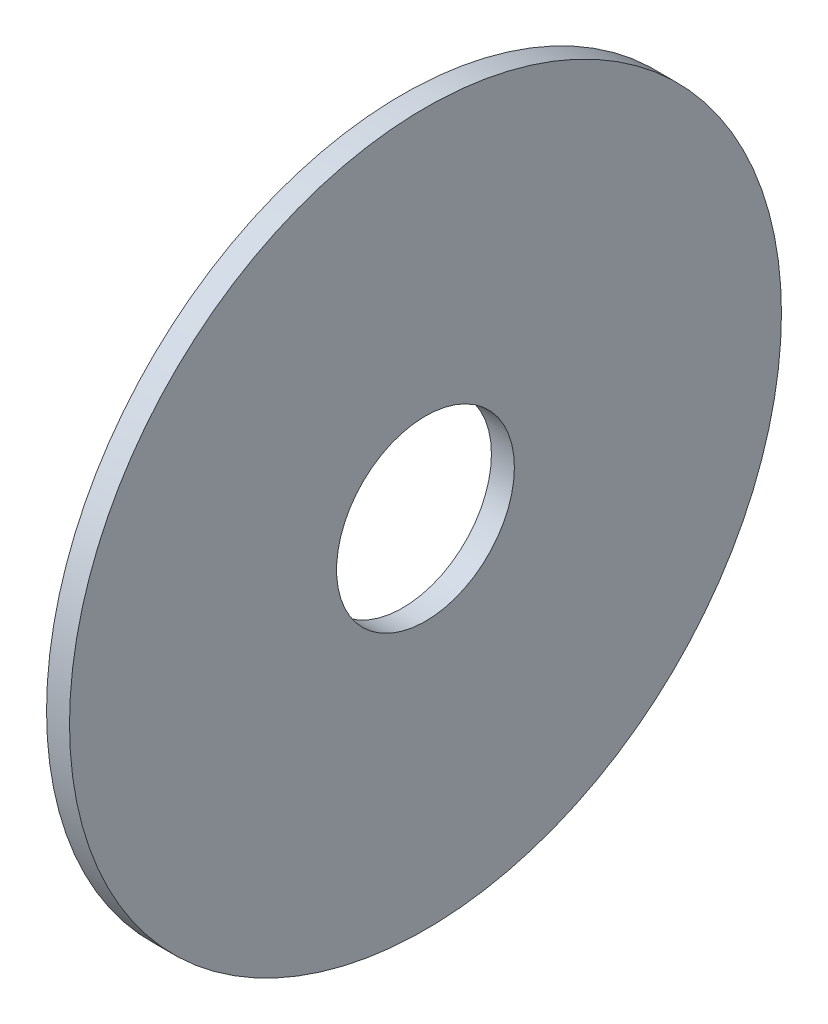
from build123d import *

# Parameters (mm, degrees)
CROQUIS1_R              = 70.07
CROQUIS1_R_2            = 17.5
SALIENTE_EXTRUIR1_DEPTH = 4.52


with BuildPart() as part:
    # Croquis1 → Saliente-Extruir1 (new body)
    with BuildSketch(Plane(origin=(0, 0, 0), x_dir=(0, 0, -1), z_dir=(1, 0, 0))):
        Circle(CROQUIS1_R)
        Circle(CROQUIS1_R_2, mode=Mode.SUBTRACT)
    extrude(amount=SALIENTE_EXTRUIR1_DEPTH)


solid = part.part
